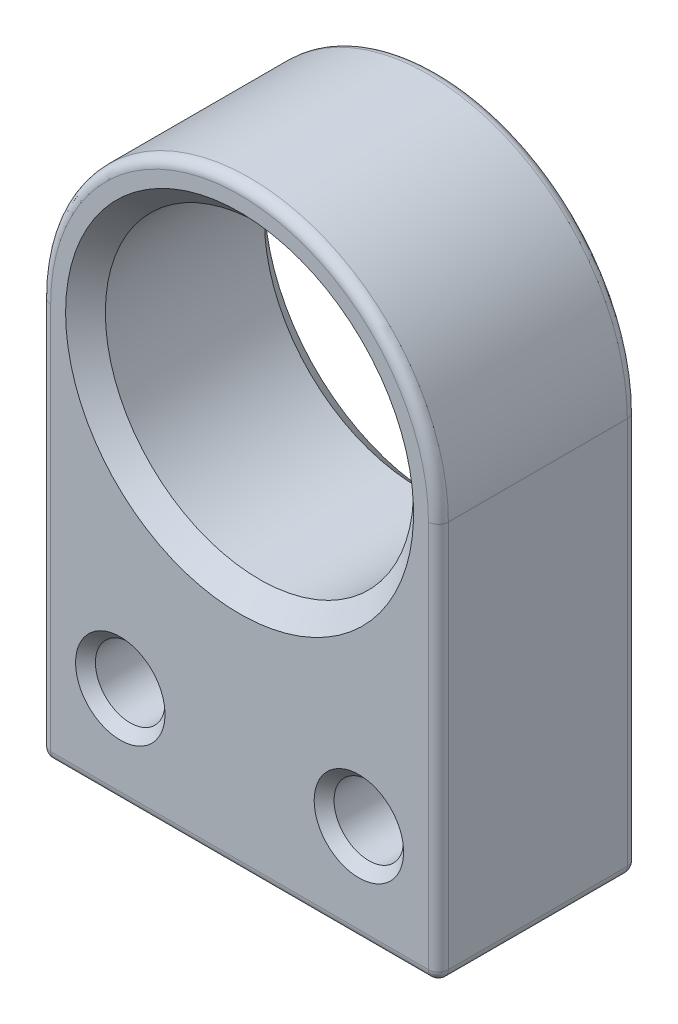
from build123d import *

# Parameters (mm, degrees)
SKETCH_1_W      = 20
SKETCH_1_H      = 10
SKETCH_1_R      = 1.75
EXTRUDE_1_DEPTH = 10
SKETCH_2_R      = 7.75
EXTRUDE_2_DEPTH = 10
CHAMFER_1_SIZE  = 1
CHAMFER_2_SIZE  = 0.5
FILLET_1_R      = 0.5


with BuildPart() as part:
    # 草图1 → 凸台-拉伸1 (new body)
    with BuildSketch(Plane.XY):
        Rectangle(SKETCH_1_W, SKETCH_1_H)
        with Locations((-6, 0)):
            Circle(SKETCH_1_R, mode=Mode.SUBTRACT)
        with Locations((6, 0)):
            Circle(SKETCH_1_R, mode=Mode.SUBTRACT)
    extrude(amount=EXTRUDE_1_DEPTH)

    # 草图2 → 凸台-拉伸2 (add)
    with BuildSketch(Plane.XY.offset(10)):
        with BuildLine():
            Line((-10, 15), (-10, 5))
            Line((-10, 5), (10, 5))
            Line((10, 5), (10, 15))
            ThreePointArc((10, 15), (0, 25), (-10, 15))
        make_face()
        with Locations((0, 15)):
            Circle(SKETCH_2_R, mode=Mode.SUBTRACT)
    extrude(amount=-EXTRUDE_2_DEPTH)

    # 倒角1
    chamfer_1_edges = [part.edges().sort_by_distance(p)[0] for p in [
        (-7.75, 15, 10),
        (-7.75, 15, 0),
    ]]
    chamfer(chamfer_1_edges, length=CHAMFER_1_SIZE)

    # 倒角2
    chamfer_2_edges = [part.edges().sort_by_distance(p)[0] for p in [
        (-7.75, 0, 0),
        (-7.75, 0, 10),
        (4.25, 0, 0),
        (4.25, 0, 10),
    ]]
    chamfer(chamfer_2_edges, length=CHAMFER_2_SIZE)

    # 圆角1
    fillet_1_edges = [part.edges().sort_by_distance(p)[0] for p in [
        (-10, 5, 10),
        (0, -5, 10),
        (0, 25, 0),
        (0, 25, 10),
        (10, 5, 10),
        (0, -5, 0),
        (-10, 5, 0),
        (10, 5, 0),
        (10, -5, 5),
        (-10, -5, 5),
    ]]
    fillet(fillet_1_edges, radius=FILLET_1_R)


solid = part.part
